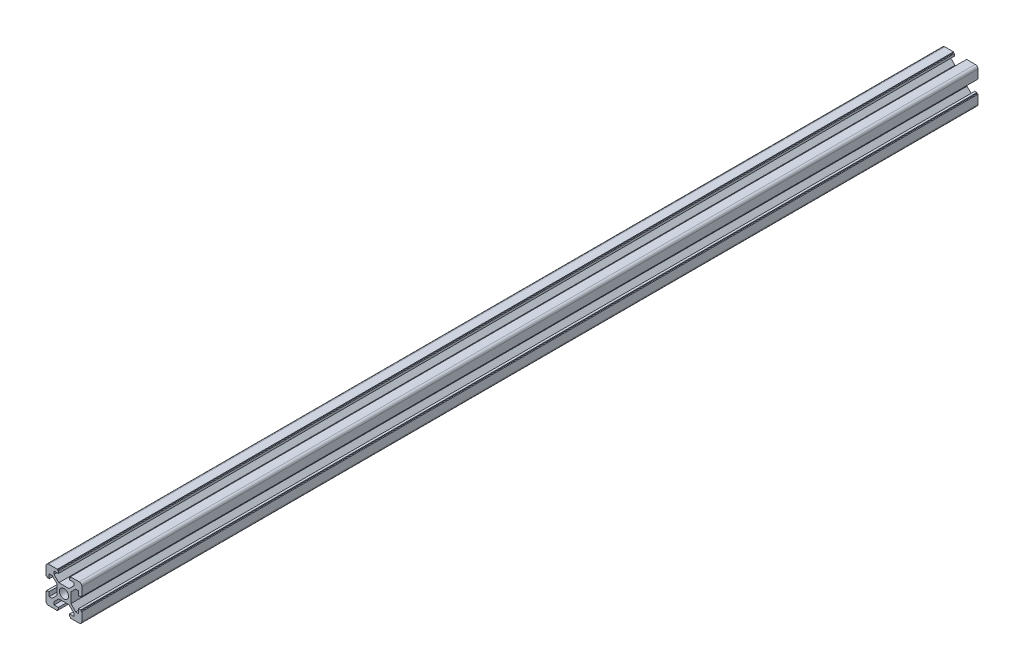
from build123d import *

# Parameters (mm, degrees)
BOSS_EXTRUDE1_DEPTH = 500
SKETCH3_R           = 2.55
CUT_EXTRUDE1_DEPTH  = 501.199960016
FILLET1_R           = 1.5


with BuildPart() as part:
    # Sketch2 → Boss-Extrude1 (new body)
    with BuildSketch(Plane.XY):
        Polygon((-10, 10), (-3.65, 10), (-3.65, 9.45), (-3.1, 9.45), (-3.1, 8.2), (-5.5, 8.2), (-5.5, 6.560660172), (-2.839339828, 3.9), (0, 3.9), (2.839339828, 3.9), (5.5, 6.560660172), (5.5, 8.2), (3.1, 8.2), (3.1, 9.45), (3.65, 9.45), (3.65, 10), (10, 10), (10, 3.65), (9.45, 3.65), (9.45, 3.1), (8.2, 3.1), (8.2, 5.5), (6.560660172, 5.5), (3.9, 2.839339828), (3.9, 0), (3.9, -2.839339828), (6.560660172, -5.5), (8.2, -5.5), (8.2, -3.1), (9.45, -3.1), (9.45, -3.65), (10, -3.65), (10, -10), (3.65, -10), (3.65, -9.45), (3.1, -9.45), (3.1, -8.2), (5.5, -8.2), (5.5, -6.560660172), (2.839339828, -3.9), (0, -3.9), (-2.839339828, -3.9), (-5.5, -6.560660172), (-5.5, -8.2), (-3.1, -8.2), (-3.1, -9.45), (-3.65, -9.45), (-3.65, -10), (-10, -10), (-10, -3.65), (-9.45, -3.65), (-9.45, -3.1), (-8.2, -3.1), (-8.2, -5.5), (-6.560660172, -5.5), (-3.9, -2.839339828), (-3.9, 0), (-3.9, 2.839339828), (-6.560660172, 5.5), (-8.2, 5.5), (-8.2, 3.1), (-9.45, 3.1), (-9.45, 3.65), (-10, 3.65), align=None)
    extrude(amount=-BOSS_EXTRUDE1_DEPTH)

    # Sketch3 → Cut-Extrude1 (cut, through all)
    with BuildSketch(Plane.XY):
        Circle(SKETCH3_R)
    extrude(amount=-CUT_EXTRUDE1_DEPTH, mode=Mode.SUBTRACT)

    # Fillet1
    fillet1_edges = [part.edges().sort_by_distance(p)[0] for p in [
        (10, 10, -250),
        (10, -10, -250),
        (-10, -10, -250),
        (-10, 10, -250),
    ]]
    fillet(fillet1_edges, radius=FILLET1_R)


solid = part.part
